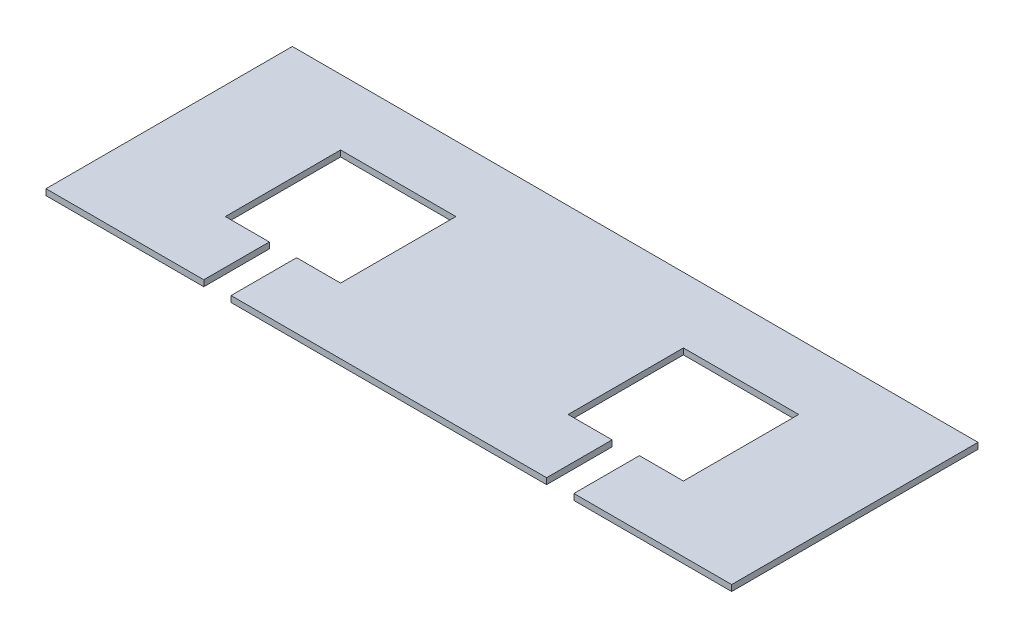
from build123d import *

# Parameters (mm, degrees)
SKETCH1_W           = 113
SKETCH1_H           = 40.6
BOSS_EXTRUDE1_DEPTH = 1
CUT_EXTRUDE1_DEPTH  = 121.076475631


with BuildPart() as part:
    # Sketch1 → Boss-Extrude1 (new body)
    with BuildSketch(Plane(origin=(0, 0, 0), x_dir=(1, 0, 0), z_dir=(0, 1, 0))):
        with Locations((56.5, 20.3)):
            Rectangle(SKETCH1_W, SKETCH1_H)
    extrude(amount=BOSS_EXTRUDE1_DEPTH)

    # Sketch2 → Cut-Extrude1 (cut, through all)
    with BuildSketch(Plane(origin=(0, 1, 0), x_dir=(1, 0, 0), z_dir=(0, 1, 0))):
        Polygon((37.75, 10.8), (30.5, 10.8), (30.5, 0), (26, 0), (26, 10.8), (18.75, 10.8), (18.75, 29.8), (37.75, 29.8), align=None)
    cut_extrude1 = extrude(amount=-CUT_EXTRUDE1_DEPTH, mode=Mode.SUBTRACT)

    # Mirror1: Cut-Extrude1 across plane
    add(cut_extrude1.mirror(Plane.ZY.offset(-56.5)), mode=Mode.SUBTRACT)


solid = part.part
